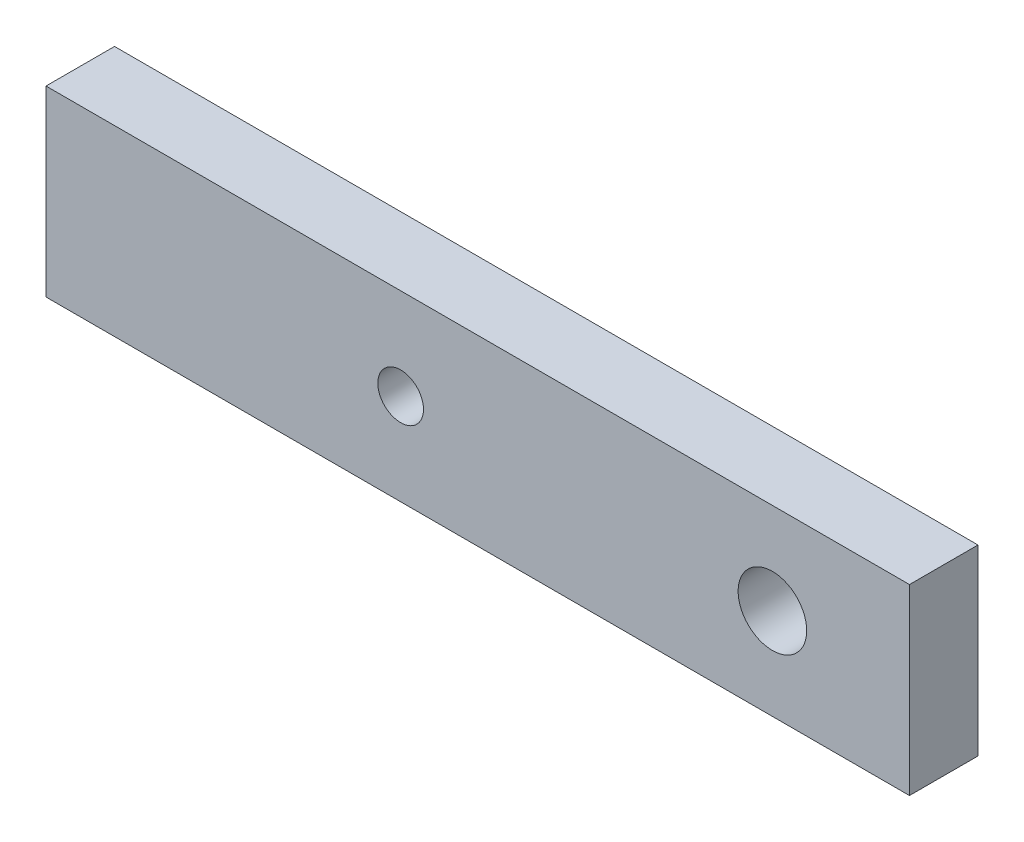
from build123d import *

# Parameters (mm, degrees)
SKETCH_272_W      = 1890
SKETCH_272_H      = 400
SKETCH_272_R      = 75
SKETCH_272_R_2    = 50
EXTRUDE_432_DEPTH = 150


with BuildPart() as part:
    # Sketch 272 → Extrude 432 (new body)
    with BuildSketch(Plane.XY):
        with Locations((-945, 200)):
            Rectangle(SKETCH_272_W, SKETCH_272_H)
        with Locations((-300, 200)):
            Circle(SKETCH_272_R, mode=Mode.SUBTRACT)
        with Locations((-1113.709502285, 200)):
            Circle(SKETCH_272_R_2, mode=Mode.SUBTRACT)
    extrude(amount=EXTRUDE_432_DEPTH)


solid = part.part
